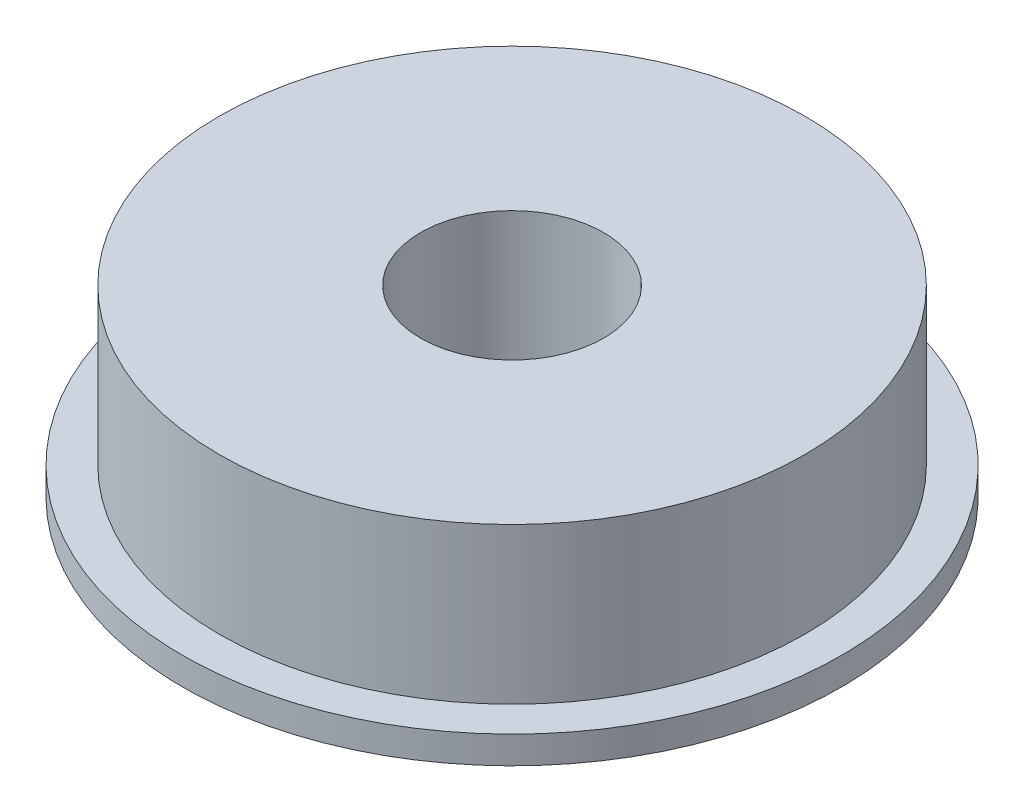
from build123d import *

# Parameters (mm, degrees)
SKETCH2_R          = 2.5
CUT_EXTRUDE1_DEPTH = 14.674794331


with BuildPart() as part:
    # Sketch1 → Revolve1 (revolve)
    with BuildSketch(Plane(origin=(0, 0, 0), x_dir=(0, 0, -1), z_dir=(1, 0, 0))):
        Polygon((0, 0), (0, 5), (8, 5), (8, 0.75), (9, 0.75), (9, 0), align=None)
    revolve(axis=Axis((0, 0, 0), (0, 1, 0)))

    # Sketch2 → Cut-Extrude1 (cut, through all)
    with BuildSketch(Plane(origin=(0, 5, 0), x_dir=(1, 0, 0), z_dir=(0, 1, 0))):
        with Locations(Location((0, 0, 0), (0, 0, 270))):
            Circle(SKETCH2_R)
    extrude(amount=-CUT_EXTRUDE1_DEPTH, mode=Mode.SUBTRACT)


solid = part.part
